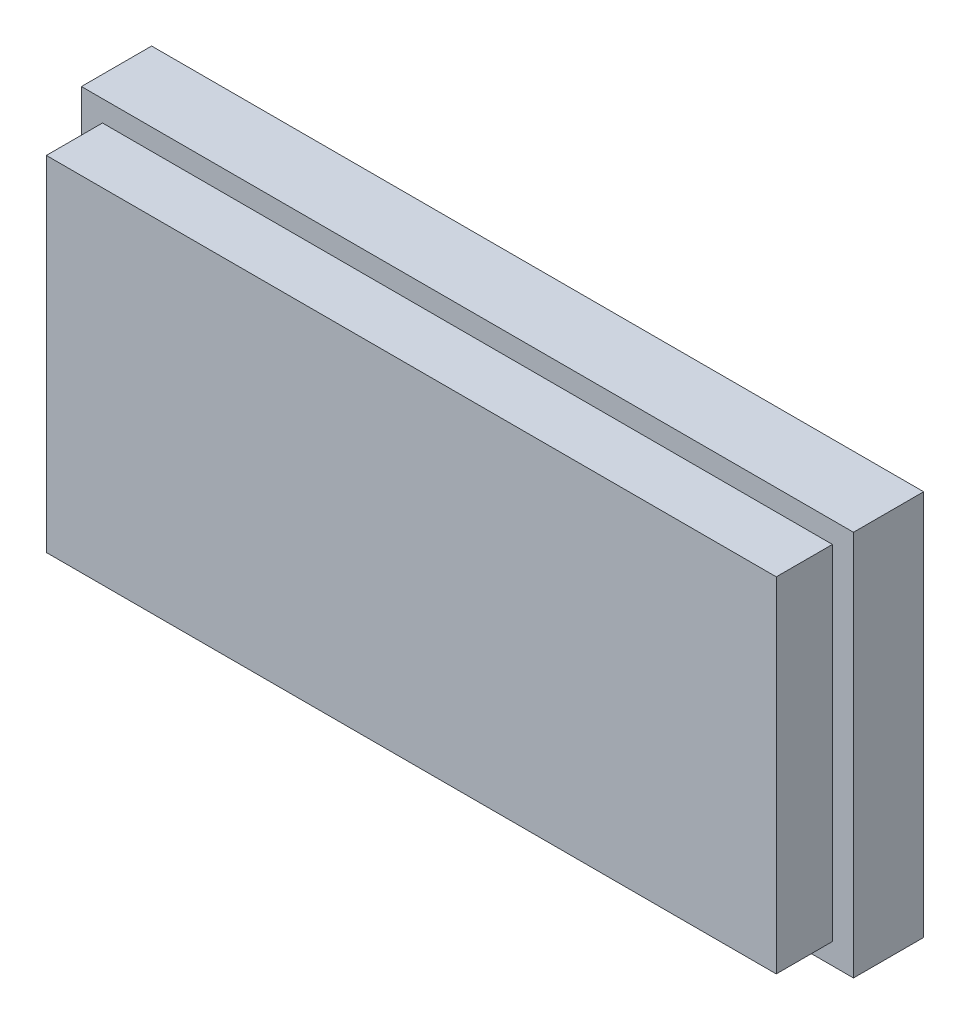
from build123d import *

# Parameters (mm, degrees)
SKETCH3_W           = 104
SKETCH3_H           = 49
BOSS_EXTRUDE1_DEPTH = 18
SKETCH3_3_W         = 110
SKETCH3_3_H         = 55
SKETCH3_3_W_2       = 104
SKETCH3_3_H_2       = 49
BOSS_EXTRUDE2_DEPTH = 10


with BuildPart() as part:
    # Sketch3 → Boss-Extrude1 (new body)
    with BuildSketch(Plane.XY):
        Rectangle(SKETCH3_W, SKETCH3_H)
    extrude(amount=BOSS_EXTRUDE1_DEPTH)

    # Sketch3<3> → Boss-Extrude2 (add)
    with BuildSketch(Plane.XY):
        Rectangle(SKETCH3_3_W, SKETCH3_3_H)
        Rectangle(SKETCH3_3_W_2, SKETCH3_3_H_2, mode=Mode.SUBTRACT)
    extrude(amount=BOSS_EXTRUDE2_DEPTH)


solid = part.part
